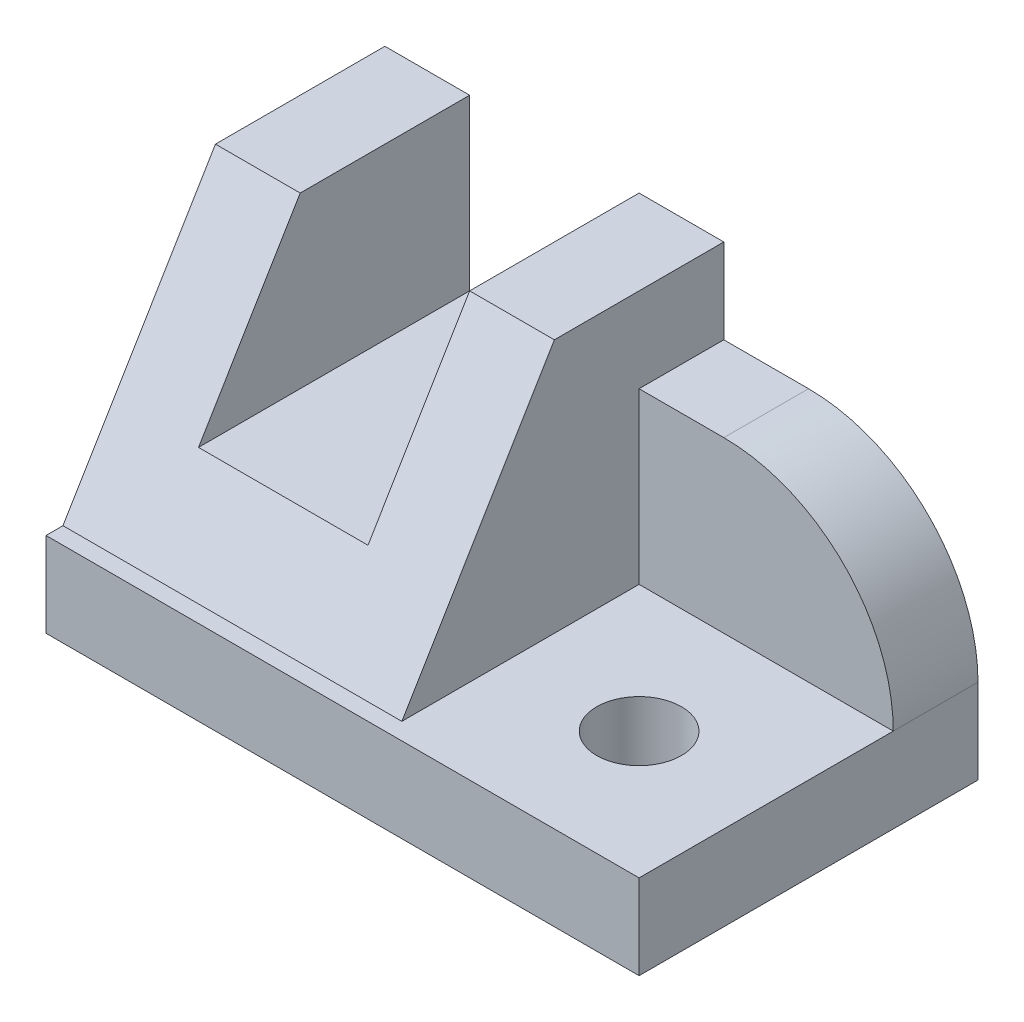
from build123d import *

# Parameters (mm, degrees)
BOSS_EXTRUDE1_DEPTH            = 40
SKETCH2_W                      = 40
SKETCH2_H                      = 30
BOSS_EXTRUDE2_DEPTH            = 20
BOSS_EXTRUDE3_DEPTH            = 30
CUT_EXTRUDE1_DEPTH             = 30
SKETCH5_W                      = 70
SKETCH5_H                      = 40
BOSS_EXTRUDE4_DEPTH            = 10
SKETCH6_W                      = 20
SKETCH6_H                      = 20
CUT_EXTRUDE2_DEPTH             = 91
F_10_0_10_DIAMETER_HOLE1_D     = 10
F_10_0_10_DIAMETER_HOLE1_DEPTH = 40
FILLET1_R                      = 20


with BuildPart() as part:
    # Sketch1 → Boss-Extrude1 (new body)
    with BuildSketch(Plane(origin=(0, 0, 0), x_dir=(0, -1, 0), z_dir=(-1, 0, 0))):
        Polygon((-10, -2), (-40, -20), (-10, -20), align=None)
    extrude(amount=-BOSS_EXTRUDE1_DEPTH)

    # Sketch2 → Boss-Extrude2 (add)
    with BuildSketch(Plane(origin=(0, 0, -20), x_dir=(-1, 0, 0), z_dir=(0, 0, -1))):
        with Locations((-20, 25)):
            Rectangle(SKETCH2_W, SKETCH2_H)
    extrude(amount=BOSS_EXTRUDE2_DEPTH)

    # Sketch3 → Boss-Extrude3 (add)
    with BuildSketch(Plane(origin=(40, 0, 0), x_dir=(0, 0, -1), z_dir=(1, 0, 0))):
        Polygon((40, 10), (0, 10), (20, 40), (40, 40), align=None)
    extrude(amount=BOSS_EXTRUDE3_DEPTH)

    # Sketch4 → Cut-Extrude1 (cut)
    with BuildSketch(Plane(origin=(70, 0, 0), x_dir=(0, 0, -1), z_dir=(1, 0, 0))):
        Polygon((20, 40), (0, 10), (30, 10), (30, 30), (40, 30), (40, 40), align=None)
    extrude(amount=-CUT_EXTRUDE1_DEPTH, mode=Mode.SUBTRACT)

    # Sketch5 → Boss-Extrude4 (add)
    with BuildSketch(Plane.XZ.offset(-10)):
        with Locations((35, -20)):
            Rectangle(SKETCH5_W, SKETCH5_H)
    extrude(amount=BOSS_EXTRUDE4_DEPTH)

    # Sketch6 → Cut-Extrude2 (cut, through all)
    with BuildSketch(Plane(origin=(0, 0, -40), x_dir=(-1, 0, 0), z_dir=(0, 0, -1))):
        with Locations((-20, 30)):
            Rectangle(SKETCH6_W, SKETCH6_H)
    extrude(amount=-CUT_EXTRUDE2_DEPTH, mode=Mode.SUBTRACT)

    # Ø10.0 (10) Diameter Hole1
    with Locations(Plane(origin=(0, 0, 0), x_dir=(-1, 0, 0), z_dir=(0, -1, 0))):
        with Locations((-55, 15)):
            Hole(F_10_0_10_DIAMETER_HOLE1_D / 2, depth=F_10_0_10_DIAMETER_HOLE1_DEPTH)

    # Fillet1
    fillet1_edges = [part.edges().sort_by_distance(p)[0] for p in [
        (70, 30, -35),
    ]]
    fillet(fillet1_edges, radius=FILLET1_R)


solid = part.part
